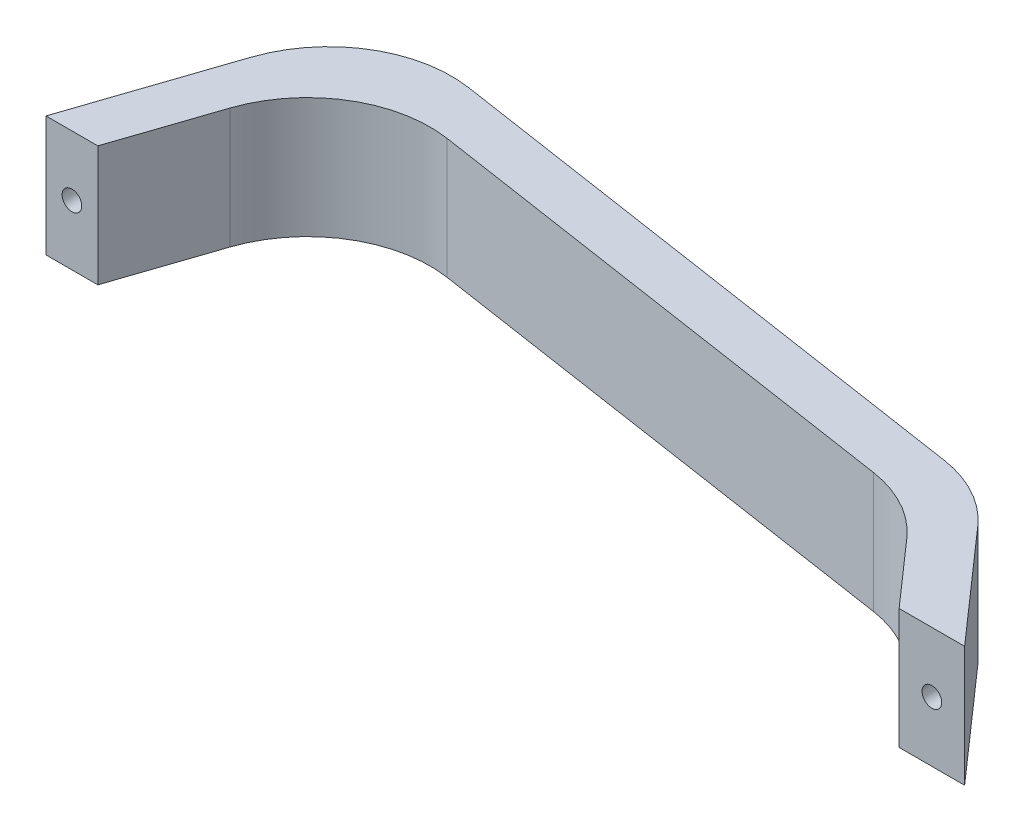
from build123d import *

# Parameters (mm, degrees)
EXTRUDE_1_DEPTH     = 24.5
FILLET_1_R          = 25
SKETCH_2_R          = 2
CUT_EXTRUDE_1_DEPTH = 5


with BuildPart() as part:
    # 草图1 → 凸台-拉伸1 (new body)
    with BuildSketch(Plane(origin=(0, 0, 0), x_dir=(1, 0, 0), z_dir=(0, 1, 0))):
        Polygon((-80, 0), (-66.524518745, 40), (65.438851804, 20), (83.060057617, 0), (96.387725214, 0), (90.563245948, 6.610761292), (70.535919799, 29.341698507), (-73.32231493, 51.144450912), (-89.476681383, 3.192571058), (-90.552217169, 0), align=None)
    extrude(amount=EXTRUDE_1_DEPTH)

    # 圆角1
    fillet_1_edges = [part.edges().sort_by_distance(p)[0] for p in [
        (-73.32231493, 12.25, -51.144450912),
        (70.535919799, 12.25, -29.341698507),
        (65.438851804, 12.25, -20),
        (-66.524518745, 12.25, -40),
    ]]
    fillet(fillet_1_edges, radius=FILLET_1_R)

    # 草图2 → 切除-拉伸1 (cut)
    with BuildSketch(Plane.XY):
        with Locations((-85.276108585, 12.25)):
            Circle(SKETCH_2_R)
        with Locations((89.723891415, 12.25)):
            Circle(SKETCH_2_R)
    extrude(amount=-CUT_EXTRUDE_1_DEPTH, mode=Mode.SUBTRACT)


solid = part.part
